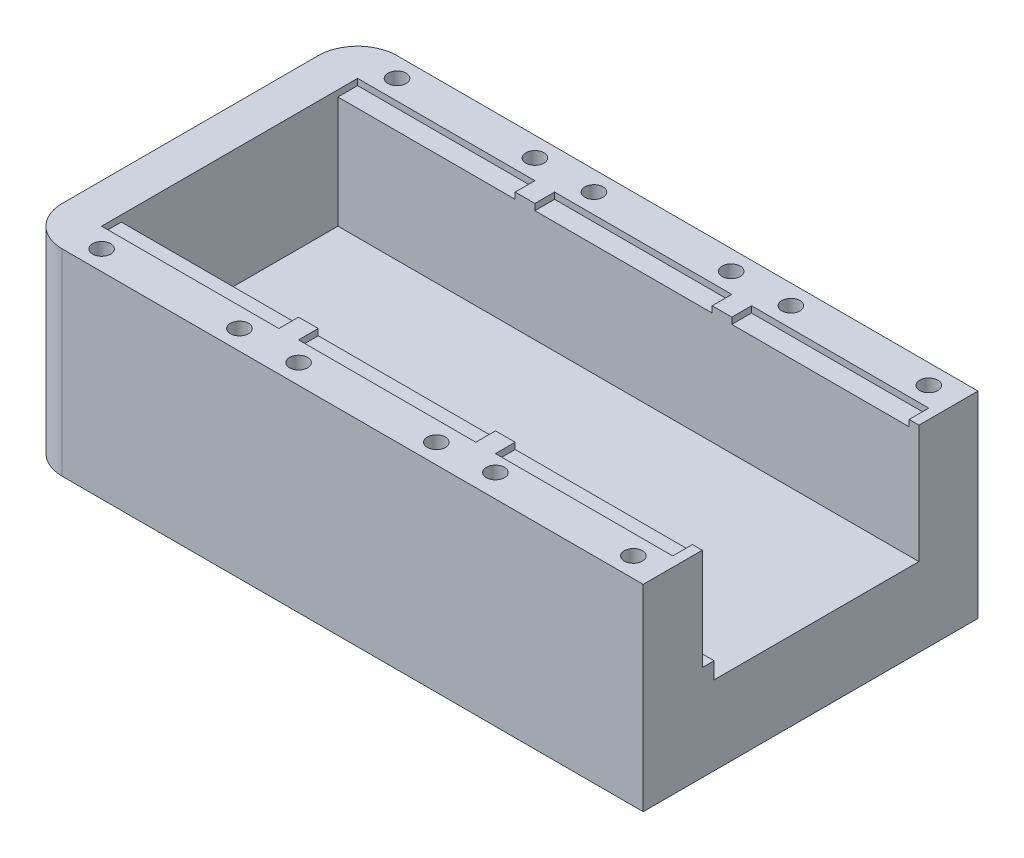
from build123d import *

# Parameters (mm, degrees)
SKIZZE2_W                       = 315
SKIZZE2_H                       = 50
AUFSATZ_LINEAR_AUSTRAGEN1_DEPTH = 85
SKIZZE4_W                       = 295
SKIZZE4_H                       = 55
SCHNITT_LINEAR_AUSTRAGEN1_DEPTH = 30
VERRUNDUNG1_R                   = 10
VERRUNDUNG2_R                   = 10
VERRUNDUNG3_R                   = 10
VERRUNDUNG4_R                   = 10
SKIZZE11_W                      = 45
SKIZZE11_H                      = 5
SKIZZE11_H_2                    = 5.008661904
SCHNITT_LINEAR_AUSTRAGEN4_DEPTH = 1.6
SKIZZE13_W                      = 295
SKIZZE13_H                      = 3
AUFSATZ_LINEAR_AUSTRAGEN2_DEPTH = 4.2
SKIZZE14_W                      = 8
SKIZZE14_H                      = 4
SCHNITT_LINEAR_AUSTRAGEN5_DEPTH = 19
SKIZZE15_W                      = 50
SKIZZE15_H                      = 1.5
AUFSATZ_LINEAR_AUSTRAGEN3_DEPTH = 2
SKIZZE16_W                      = 50
SKIZZE16_H                      = 1.5
AUFSATZ_LINEAR_AUSTRAGEN4_DEPTH = 2
SKIZZE17_R                      = 2.3
SCHNITT_LINEAR_AUSTRAGEN6_DEPTH = 4
SKIZZE19_W                      = 182.800022846
SKIZZE19_H                      = 85
SCHNITT_LINEAR_AUSTRAGEN8_DEPTH = 80


with BuildPart() as part:
    # Skizze2 → Aufsatz-Linear austragen1 (new body)
    with BuildSketch(Plane.XY):
        with Locations((157.5, 25)):
            Rectangle(SKIZZE2_W, SKIZZE2_H)
    extrude(amount=AUFSATZ_LINEAR_AUSTRAGEN1_DEPTH)

    # Skizze4 → Schnitt-Linear austragen1 (cut)
    with BuildSketch(Plane(origin=(0, 50, 0), x_dir=(1, 0, 0), z_dir=(0, 1, 0))):
        with Locations((157.5, -42.5)):
            Rectangle(SKIZZE4_W, SKIZZE4_H)
    extrude(amount=-SCHNITT_LINEAR_AUSTRAGEN1_DEPTH, mode=Mode.SUBTRACT)

    # Verrundung1
    verrundung1_edges = [part.edges().sort_by_distance(p)[0] for p in [
        (315, 25, 0),
    ]]
    fillet(verrundung1_edges, radius=VERRUNDUNG1_R)

    # Verrundung2
    verrundung2_edges = [part.edges().sort_by_distance(p)[0] for p in [
        (315, 25, 85),
    ]]
    fillet(verrundung2_edges, radius=VERRUNDUNG2_R)

    # Verrundung3
    verrundung3_edges = [part.edges().sort_by_distance(p)[0] for p in [
        (0, 25, 85),
    ]]
    fillet(verrundung3_edges, radius=VERRUNDUNG3_R)

    # Verrundung4
    verrundung4_edges = [part.edges().sort_by_distance(p)[0] for p in [
        (0, 25, 0),
    ]]
    fillet(verrundung4_edges, radius=VERRUNDUNG4_R)

    # Skizze11 → Schnitt-Linear austragen4 (cut)
    with BuildSketch(Plane(origin=(0, 50, 0), x_dir=(1, 0, 0), z_dir=(0, 1, 0))):
        with Locations((32.5, -12.5)):
            Rectangle(SKIZZE11_W, SKIZZE11_H)
        with Locations((32.5, -72.5)):
            Rectangle(SKIZZE11_W, SKIZZE11_H)
        with Locations((82.5, -72.5)):
            Rectangle(SKIZZE11_W, SKIZZE11_H)
        with Locations((132.5, -72.504330952)):
            Rectangle(SKIZZE11_W, SKIZZE11_H_2)
        with Locations((182.5, -72.504330952)):
            Rectangle(SKIZZE11_W, SKIZZE11_H_2)
        with Locations((232.5, -72.5)):
            Rectangle(SKIZZE11_W, SKIZZE11_H)
        with Locations((282.5, -72.5)):
            Rectangle(SKIZZE11_W, SKIZZE11_H)
        with Locations((282.5, -12.5)):
            Rectangle(SKIZZE11_W, SKIZZE11_H)
        with Locations((232.5, -12.5)):
            Rectangle(SKIZZE11_W, SKIZZE11_H)
        with Locations((182.5, -12.5)):
            Rectangle(SKIZZE11_W, SKIZZE11_H)
        with Locations((132.5, -12.5)):
            Rectangle(SKIZZE11_W, SKIZZE11_H)
        with Locations((82.5, -12.5)):
            Rectangle(SKIZZE11_W, SKIZZE11_H)
    extrude(amount=-SCHNITT_LINEAR_AUSTRAGEN4_DEPTH, mode=Mode.SUBTRACT)

    # Skizze13 → Aufsatz-Linear austragen2 (add)
    with BuildSketch(Plane(origin=(0, 20, 0), x_dir=(1, 0, 0), z_dir=(0, 1, 0))):
        with Locations((157.5, -68.5)):
            Rectangle(SKIZZE13_W, SKIZZE13_H)
    extrude(amount=AUFSATZ_LINEAR_AUSTRAGEN2_DEPTH)

    # Skizze14 → Schnitt-Linear austragen5 (cut)
    with BuildSketch(Plane.ZY.offset(-305)):
        with Locations((35, 24.4)):
            Rectangle(SKIZZE14_W, SKIZZE14_H)
    extrude(amount=-SCHNITT_LINEAR_AUSTRAGEN5_DEPTH, mode=Mode.SUBTRACT)

    # Skizze15 → Aufsatz-Linear austragen3 (add)
    with BuildSketch(Plane.XY.offset(15)):
        with Locations((280, 23.45)):
            Rectangle(SKIZZE15_W, SKIZZE15_H)
    extrude(amount=AUFSATZ_LINEAR_AUSTRAGEN3_DEPTH)

    # Skizze16 → Aufsatz-Linear austragen4 (add)
    with BuildSketch(Plane(origin=(0, 0, 67), x_dir=(-1, 0, 0), z_dir=(0, 0, -1))):
        with Locations((-280, 23.45)):
            Rectangle(SKIZZE16_W, SKIZZE16_H)
    extrude(amount=AUFSATZ_LINEAR_AUSTRAGEN4_DEPTH)

    # Skizze17 → Schnitt-Linear austragen6 (cut)
    with BuildSketch(Plane(origin=(0, 50, 0), x_dir=(1, 0, 0), z_dir=(0, 1, 0))):
        with Locations(Location((50, -80, 0), (0, 0, 270))):
            Circle(SKIZZE17_R)
        with Locations(Location((15, -80, 0), (0, 0, 270))):
            Circle(SKIZZE17_R)
        with Locations(Location((15, -5, 0), (0, 0, 270))):
            Circle(SKIZZE17_R)
        with Locations(Location((50, -5, 0), (0, 0, 270))):
            Circle(SKIZZE17_R)
        with Locations(Location((65, -5, 0), (0, 0, 270))):
            Circle(SKIZZE17_R)
        with Locations(Location((99.834927097, -5, 0), (0, 0, 270))):
            Circle(SKIZZE17_R)
        with Locations(Location((65, -80, 0), (0, 0, 270))):
            Circle(SKIZZE17_R)
        with Locations(Location((100, -80, 0), (0, 0, 270))):
            Circle(SKIZZE17_R)
        with Locations(Location((114.145512134, -79.164010762, 0), (0, 0, 270))):
            Circle(SKIZZE17_R)
        with Locations(Location((150, -80, 0), (0, 0, 270))):
            Circle(SKIZZE17_R)
        with Locations(Location((165, -80, 0), (0, 0, 270))):
            Circle(SKIZZE17_R)
        with Locations(Location((200, -80, 0), (0, 0, 270))):
            Circle(SKIZZE17_R)
        with Locations(Location((215, -80, 0), (0, 0, 270))):
            Circle(SKIZZE17_R)
        with Locations(Location((250, -80, 0), (0, 0, 270))):
            Circle(SKIZZE17_R)
        with Locations(Location((265, -80, 0), (0, 0, 270))):
            Circle(SKIZZE17_R)
        with Locations(Location((300, -80, 0), (0, 0, 270))):
            Circle(SKIZZE17_R)
        with Locations(Location((300, -5, 0), (0, 0, 270))):
            Circle(SKIZZE17_R)
        with Locations(Location((265, -5, 0), (0, 0, 270))):
            Circle(SKIZZE17_R)
        with Locations(Location((250, -5, 0), (0, 0, 270))):
            Circle(SKIZZE17_R)
        with Locations(Location((215, -5, 0), (0, 0, 270))):
            Circle(SKIZZE17_R)
        with Locations(Location((200, -5, 0), (0, 0, 270))):
            Circle(SKIZZE17_R)
        with Locations(Location((165, -5, 0), (0, 0, 270))):
            Circle(SKIZZE17_R)
        with Locations(Location((150, -5, 0), (0, 0, 270))):
            Circle(SKIZZE17_R)
        with Locations(Location((115, -5, 0), (0, 0, 270))):
            Circle(SKIZZE17_R)
    extrude(amount=-SCHNITT_LINEAR_AUSTRAGEN6_DEPTH, mode=Mode.SUBTRACT)

    # Skizze19 → Schnitt-Linear austragen8 (cut)
    with BuildSketch(Plane(origin=(0, 50, 0), x_dir=(1, 0, 0), z_dir=(0, 1, 0))):
        with Locations((248.900011423, -42.5)):
            Rectangle(SKIZZE19_W, SKIZZE19_H)
    extrude(amount=-SCHNITT_LINEAR_AUSTRAGEN8_DEPTH, mode=Mode.SUBTRACT)


solid = part.part
